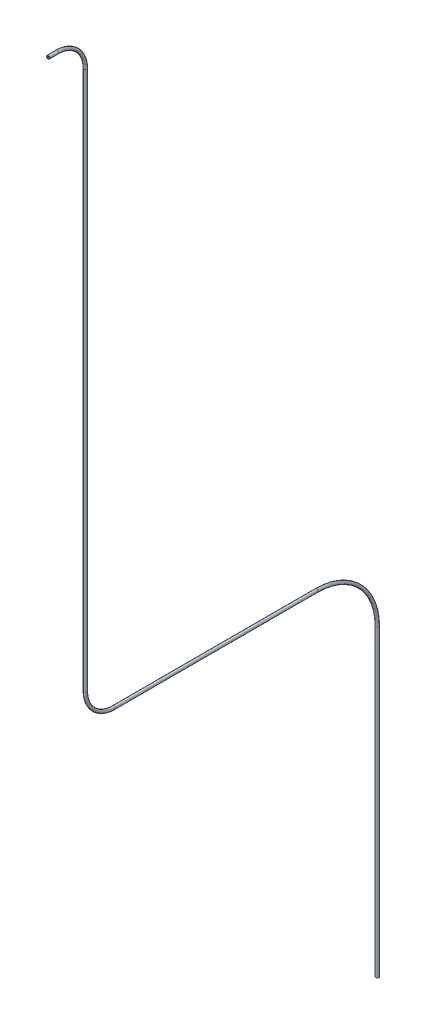
from build123d import *

# Parameters (mm, degrees)
SWEEP_THIN1_PROFILE_R   = 0.39
SWEEP_THIN1_PROFILE_R_2 = 0.19


with BuildPart() as part:
    # Sweep-Thin1: sweep along a curve in space
    with BuildLine() as sweep_thin1_path:
        Line((0, 0, 0), (0, 0, -2.2))
        ThreePointArc((0, 0, -2.2), (0, -2.050252532, -7.149747468), (0, -7, -9.2))
        Line((0, -7, -9.2), (0, -140, -9.2))
        ThreePointArc((0, -140, -9.2), (0, -144.949747468, -11.250252532), (0, -147, -16.2))
        Line((0, -147, -16.2), (0, -147, -66.2))
        ThreePointArc((0, -147, -66.2), (0, -151.393398282, -76.806601718), (0, -162, -81.2))
        Line((0, -162, -81.2), (0, -237, -81.2))
    # Sweep-Thin1 profile (on start of the path) → Sweep-Thin1 (sweep)
    with BuildSketch(Plane(origin=(0, 0, 0), x_dir=(-1, 0, 0), z_dir=(0, 0, -1))):
        Circle(SWEEP_THIN1_PROFILE_R)
        Circle(SWEEP_THIN1_PROFILE_R_2, mode=Mode.SUBTRACT)
    sweep(path=sweep_thin1_path.line)


solid = part.part
